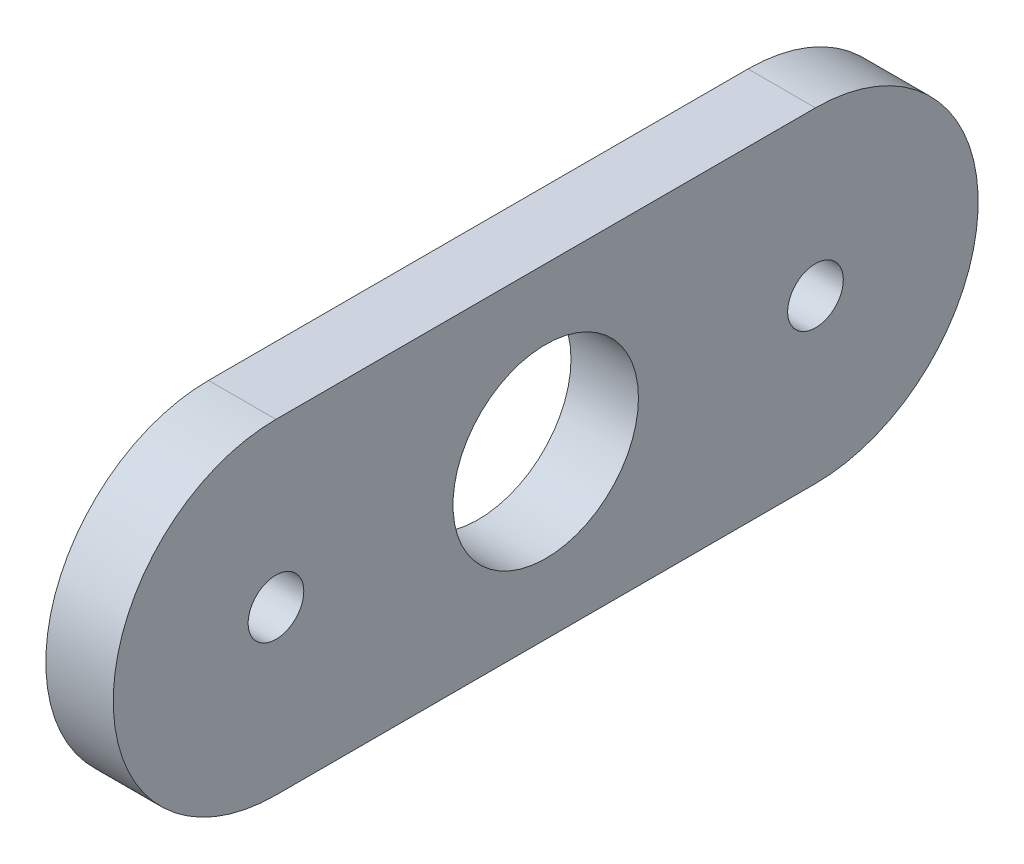
from build123d import *

# Parameters (mm, degrees)
SKETCH1_R           = 1.65
SKETCH1_R_2         = 5.5
BOSS_EXTRUDE1_DEPTH = 4


with BuildPart() as part:
    # Sketch1 → Boss-Extrude1 (new body)
    with BuildSketch(Plane(origin=(0, 0, 0), x_dir=(0, 0, -1), z_dir=(1, 0, 0))):
        with BuildLine():
            Line((-16, 9.65), (16, 9.65))
            ThreePointArc((16, 9.65), (25.65, 0), (16, -9.65))
            Line((16, -9.65), (-16, -9.65))
            ThreePointArc((-16, -9.65), (-25.65, 0), (-16, 9.65))
        make_face()
        with Locations((-16, 0)):
            Circle(SKETCH1_R, mode=Mode.SUBTRACT)
        with Locations((16, 0)):
            Circle(SKETCH1_R, mode=Mode.SUBTRACT)
        Circle(SKETCH1_R_2, mode=Mode.SUBTRACT)
    extrude(amount=BOSS_EXTRUDE1_DEPTH)


solid = part.part
